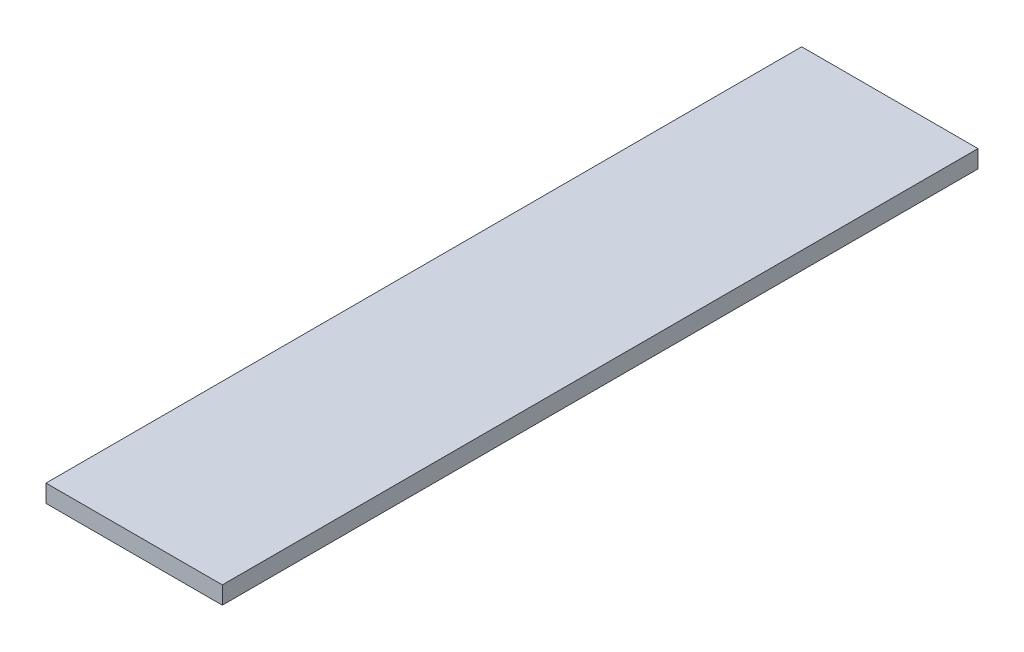
from build123d import *

# Parameters (mm, degrees)
SKETCH2_W           = 70
SKETCH2_H           = 7
BOSS_EXTRUDE1_DEPTH = 300


with BuildPart() as part:
    # Sketch2 → Boss-Extrude1 (new body)
    with BuildSketch(Plane.XY):
        with Locations((35, 3.5)):
            Rectangle(SKETCH2_W, SKETCH2_H)
    extrude(amount=-BOSS_EXTRUDE1_DEPTH)


solid = part.part
